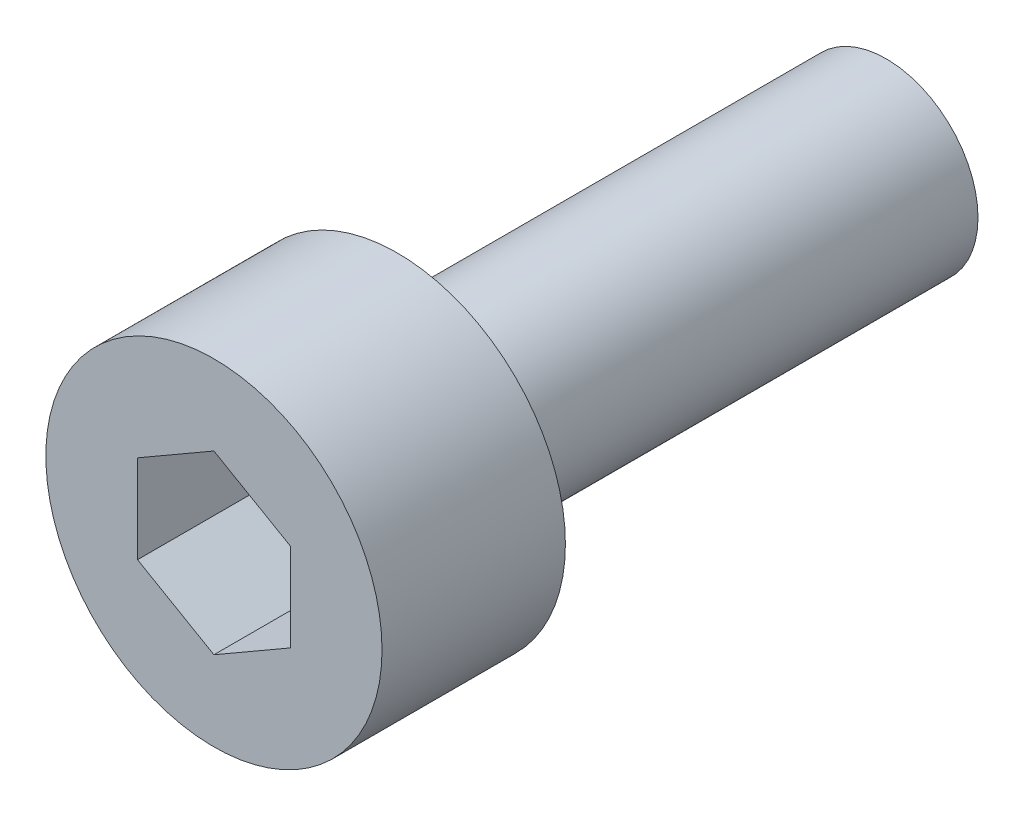
from build123d import *

# Parameters (mm, degrees)
THREAD_ENVELOPE_START = -8
PROFILE_1_R           = 1.5
THREAD_ENVELOPE_DEPTH = 8
PROFILE_2_R           = 2.75
SOCKET_HEAD_DEPTH     = 3


with BuildPart() as part:
    # Profile_1 → Thread_envelope (new body)
    with BuildSketch(Plane.XY.offset(THREAD_ENVELOPE_START)):
        Circle(PROFILE_1_R)
    extrude(amount=THREAD_ENVELOPE_DEPTH)

    # Profile_2 → Socket_head (add)
    with BuildSketch(Plane.XY):
        Circle(PROFILE_2_R)
        Polygon((1.25, 0.721687836), (0, 1.443375673), (-1.25, 0.721687836), (-1.25, -0.721687836), (0, -1.443375673), (1.25, -0.721687836), align=None, mode=Mode.SUBTRACT)
    extrude(amount=SOCKET_HEAD_DEPTH)


solid = part.part
